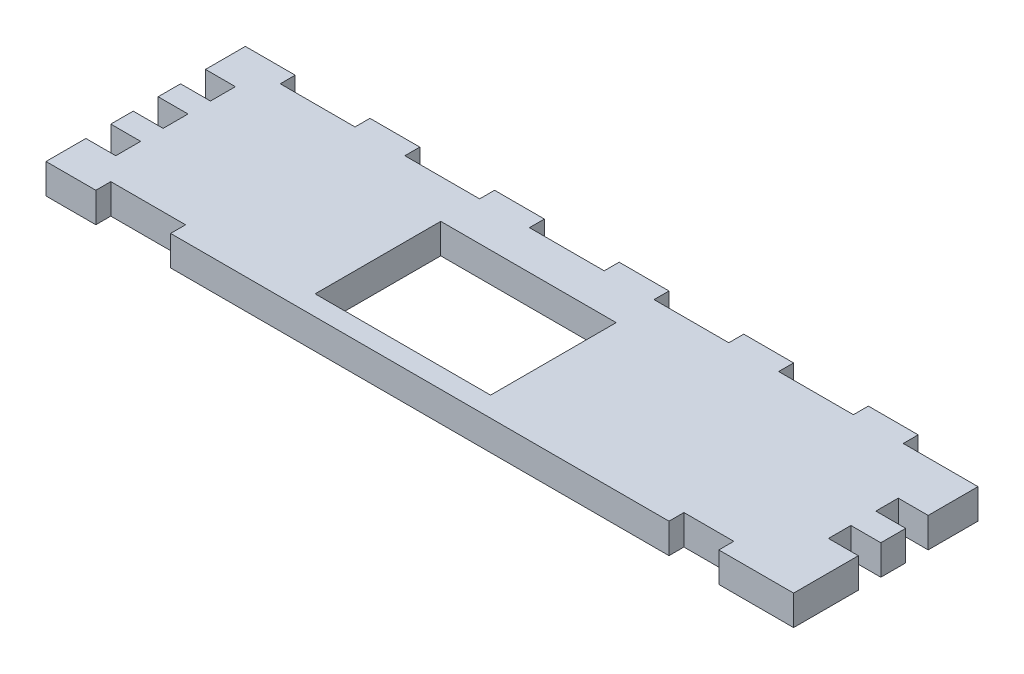
from build123d import *

# Parameters (mm, degrees)
SKETCH_1_W             = 150
SKETCH_1_H             = 36
EXTRUDE_2_DEPTH        = 6
SKETCH_6_W             = 10
SKETCH_6_H             = 6
EXTRUDE_4_DEPTH        = 4
PATTERN_LINEAR_1_COUNT = 6
PATTERN_LINEAR_1_PITCH = 25
SKETCH_8_W             = 5
SKETCH_8_H             = 6
SKETCH_8_W_2           = 4.995224333
CUT_EXTRUDE_3_DEPTH    = 6
SKETCH_11_W            = 4.504775667
SKETCH_11_H            = 6
SKETCH_11_W_2          = 4.5
CUT_EXTRUDE_4_DEPTH    = 6
SKETCH_12_W            = 35.2
SKETCH_12_H            = 25.2
CUT_EXTRUDE_5_DEPTH    = 155.376163963
SKETCH_14_W            = 15
SKETCH_14_H            = 6
SKETCH_14_W_2          = 10
CUT_EXTRUDE_6_DEPTH    = 4
SKETCH_15_W            = 15
SKETCH_15_H            = 6
EXTRUDE_5_DEPTH        = 1
PATTERN_LINEAR_2_COUNT = 5
PATTERN_LINEAR_2_PITCH = 25
SKETCH_16_W            = 15
SKETCH_16_H            = 6
EXTRUDE_6_DEPTH        = 1
SKETCH_17_W            = 10
SKETCH_17_H            = 6
EXTRUDE_7_DEPTH        = 1
SKETCH_18_W            = 15
SKETCH_18_H            = 6
EXTRUDE_8_DEPTH        = 1


with BuildPart() as part:
    # Эскиз1 → Бобышка-Вытянуть2 (new body)
    with BuildSketch(Plane(origin=(0, 0, 0), x_dir=(1, 0, 0), z_dir=(0, 1, 0))):
        with Locations((75, -18)):
            Rectangle(SKETCH_1_W, SKETCH_1_H)
    extrude(amount=EXTRUDE_2_DEPTH)

    # Эскиз6 → Бобышка-Вытянуть4 (add)
    with BuildSketch(Plane(origin=(0, 0, 0), x_dir=(-1, 0, 0), z_dir=(0, 0, -1))):
        with Locations((-5, 3)):
            Rectangle(SKETCH_6_W, SKETCH_6_H)
    extrude_4 = extrude(amount=EXTRUDE_4_DEPTH)

    # Линейный массив1: Бобышка-Вытянуть4 ×6
    with Locations(*[(i * PATTERN_LINEAR_1_PITCH, 0, 0) for i in range(1, PATTERN_LINEAR_1_COUNT)]):
        add(extrude_4)

    # Эскиз8 → Вырез-Вытянуть3 (cut)
    with BuildSketch(Plane.ZY):
        with Locations((6.5, 3)):
            Rectangle(SKETCH_8_W, SKETCH_8_H)
        with Locations((16, 3)):
            Rectangle(SKETCH_8_W, SKETCH_8_H)
        with Locations((25.502387834, 3)):
            Rectangle(SKETCH_8_W_2, SKETCH_8_H)
    extrude(amount=-CUT_EXTRUDE_3_DEPTH, mode=Mode.SUBTRACT)

    # Эскиз11 → Вырез-Вытянуть4 (cut)
    with BuildSketch(Plane(origin=(150, 0, 0), x_dir=(0, 0, -1), z_dir=(1, 0, 0))):
        with Locations((-20.752387834, 3)):
            Rectangle(SKETCH_11_W, SKETCH_11_H)
        with Locations((-11.25, 3)):
            Rectangle(SKETCH_11_W_2, SKETCH_11_H)
    extrude(amount=-CUT_EXTRUDE_4_DEPTH, mode=Mode.SUBTRACT)

    # Эскиз12 → Вырез-Вытянуть5 (cut, through all)
    with BuildSketch(Plane(origin=(0, 6, 0), x_dir=(1, 0, 0), z_dir=(0, 1, 0))):
        with Locations((67.6, -19.4)):
            Rectangle(SKETCH_12_W, SKETCH_12_H)
    extrude(amount=-CUT_EXTRUDE_5_DEPTH, mode=Mode.SUBTRACT)

    # Эскиз14 → Вырез-Вытянуть6 (cut)
    with BuildSketch(Plane.XY.offset(36)):
        with Locations((17.5, 3)):
            Rectangle(SKETCH_14_W, SKETCH_14_H)
        with Locations((130, 3)):
            Rectangle(SKETCH_14_W_2, SKETCH_14_H)
    extrude(amount=-CUT_EXTRUDE_6_DEPTH, mode=Mode.SUBTRACT)

    # Эскиз15 → Бобышка-Вытянуть5 (add)
    with BuildSketch(Plane(origin=(0, 0, 0), x_dir=(-1, 0, 0), z_dir=(0, 0, -1))):
        with Locations((-17.5, 3)):
            Rectangle(SKETCH_15_W, SKETCH_15_H)
    extrude_5 = extrude(amount=EXTRUDE_5_DEPTH)

    # Линейный массив2: Бобышка-Вытянуть5 ×5
    with Locations(*[(i * PATTERN_LINEAR_2_PITCH, 0, 0) for i in range(1, PATTERN_LINEAR_2_COUNT)]):
        add(extrude_5)

    # Эскиз16 → Бобышка-Вытянуть6 (add)
    with BuildSketch(Plane(origin=(0, 0, 0), x_dir=(-1, 0, 0), z_dir=(0, 0, -1))):
        with Locations((-142.5, 3)):
            Rectangle(SKETCH_16_W, SKETCH_16_H)
    extrude(amount=EXTRUDE_6_DEPTH)

    # Эскиз17 → Бобышка-Вытянуть7 (add)
    with BuildSketch(Plane.XY.offset(32)):
        with Locations((130, 3)):
            Rectangle(SKETCH_17_W, SKETCH_17_H)
    extrude(amount=EXTRUDE_7_DEPTH)

    # Эскиз18 → Бобышка-Вытянуть8 (add)
    with BuildSketch(Plane.XY.offset(32)):
        with Locations((17.5, 3)):
            Rectangle(SKETCH_18_W, SKETCH_18_H)
    extrude(amount=EXTRUDE_8_DEPTH)


solid = part.part
